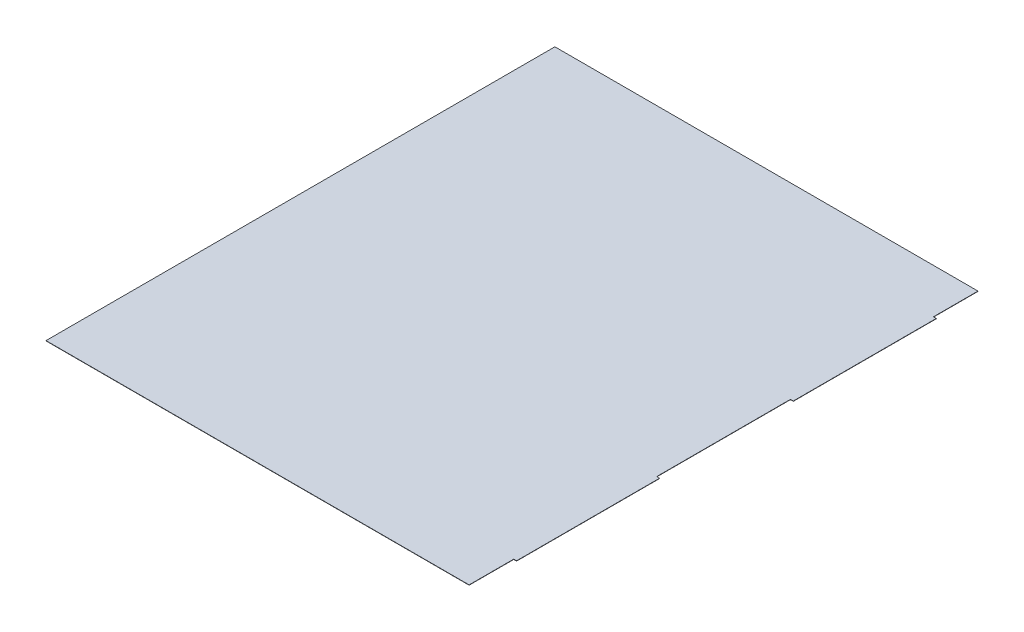
from build123d import *

# Parameters (mm, degrees)
BOSS_EXTRUDE1_DEPTH = 5
SKETCH2_W           = 50
SKETCH2_H           = 2500
BOSS_EXTRUDE2_DEPTH = 5


with BuildPart() as part:
    # Sketch1 → Boss-Extrude1 (new body)
    with BuildSketch(Plane(origin=(0, 0, 0), x_dir=(1, 0, 0), z_dir=(0, 1, 0))):
        Polygon((-3700, -4450), (3700, -4450), (3700, 4450), (3300, 4450), (3259.892103949, 4450), (2200, 4450), (2159.170676492, 4450), (-3700, 4450), align=None)
    extrude(amount=BOSS_EXTRUDE1_DEPTH)

    # Sketch2 → Boss-Extrude2 (add)
    with BuildSketch(Plane(origin=(0, 5, 0), x_dir=(1, 0, 0), z_dir=(0, 1, 0))):
        with Locations((3725, -2420)):
            Rectangle(SKETCH2_W, SKETCH2_H)
        with Locations((3725, 2420)):
            Rectangle(SKETCH2_W, SKETCH2_H)
    extrude(amount=-BOSS_EXTRUDE2_DEPTH)


solid = part.part
